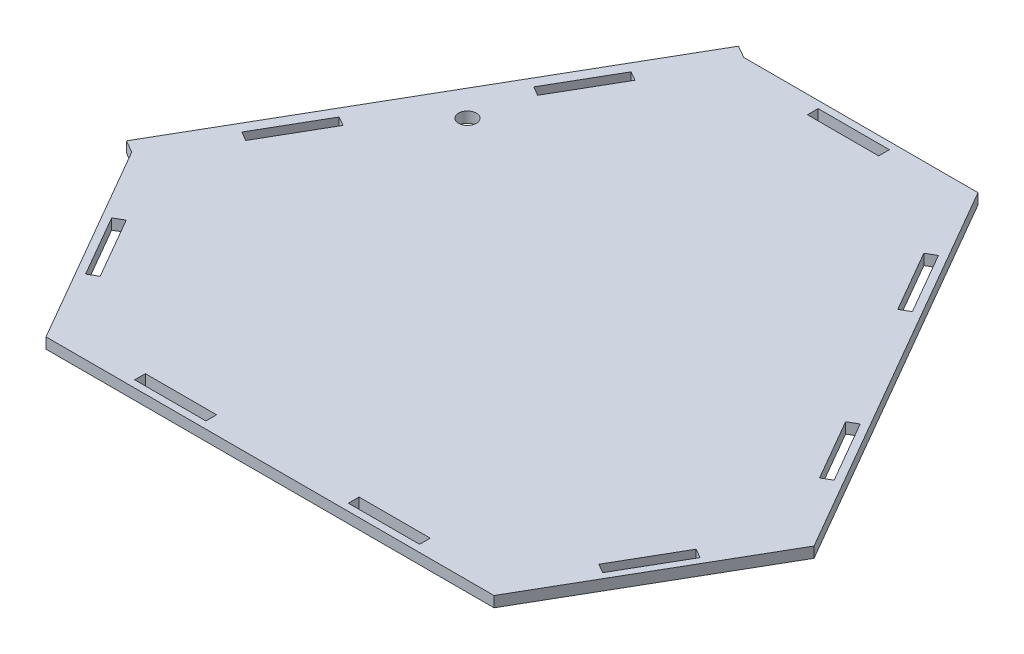
from build123d import *

# Parameters (mm, degrees)
BOSS_EXTRUDE1_DEPTH = 3
BOSS_EXTRUDE2_DEPTH = 3
SKETCH6_R           = 2.5
CUT_EXTRUDE1_DEPTH  = 137.449762455
SKETCH7_W           = 20
SKETCH7_H           = 3
CUT_EXTRUDE2_DEPTH  = 137.449762455


with BuildPart() as part:
    # Sketch4 → Boss-Extrude1 (new body)
    with BuildSketch(Plane(origin=(0, 0, 0), x_dir=(1, 0, 0), z_dir=(0, 1, 0))):
        Polygon((-32.886751346, 91.602540378), (32.886751346, 91.602540378), (95.773502692, -17.320508076), (62.886751346, -74.282032303), (-62.886751346, -74.282032303), (-95.773502692, -17.320508076), align=None)
    extrude(amount=-BOSS_EXTRUDE1_DEPTH)

    # Sketch5 → Boss-Extrude2 (add, through all)
    with BuildSketch(Plane(origin=(0, 0, 0), x_dir=(1, 0, 0), z_dir=(0, 1, 0))):
        Polygon((-95.773502692, -17.320508076), (-32.886751346, 91.602540378), (-36.350852961, 93.602540378), (-99.237604307, -15.320508076), align=None)
    extrude(amount=-BOSS_EXTRUDE2_DEPTH)

    # Sketch6 → Cut-Extrude1 (cut, through all)
    with BuildSketch(Plane(origin=(0, 0, 0), x_dir=(1, 0, 0), z_dir=(0, 1, 0))):
        with Locations(Location((-56.883974596, 38.038130468, 0), (0, 0, 270))):
            Circle(SKETCH6_R)
    extrude(amount=-CUT_EXTRUDE1_DEPTH, mode=Mode.SUBTRACT)

    # Sketch7 → Cut-Extrude2 (cut, through all)
    with BuildSketch(Plane(origin=(0, 0, 0), x_dir=(1, 0, 0), z_dir=(0, 1, 0))):
        with Locations((0, 88.102540378)):
            Rectangle(SKETCH7_W, SKETCH7_H)
        with Locations((-30, -70.782032303)):
            Rectangle(SKETCH7_W, SKETCH7_H)
        with Locations((30, -70.782032303)):
            Rectangle(SKETCH7_W, SKETCH7_H)
        Polygon((50, 51.961524227), (40, 69.282032303), (42.598076211, 70.782032303), (52.598076211, 53.461524227), align=None)
        Polygon((72.598076211, 18.820508076), (70, 17.320508076), (80, 0), (82.598076211, 1.5), align=None)
        Polygon((80, -34.641016151), (70, -51.961524227), (72.598076211, -53.461524227), (82.598076211, -36.141016151), align=None)
        Polygon((-70, -51.961524227), (-80, -34.641016151), (-82.598076211, -36.141016151), (-72.598076211, -53.461524227), align=None)
        Polygon((-45.196152423, 72.282032303), (-55.196152423, 54.961524227), (-52.598076211, 53.461524227), (-42.598076211, 70.782032303), align=None)
        Polygon((-75.196152423, 20.320508076), (-85.196152423, 3), (-82.598076211, 1.5), (-72.598076211, 18.820508076), align=None)
    extrude(amount=-CUT_EXTRUDE2_DEPTH, mode=Mode.SUBTRACT)


solid = part.part
